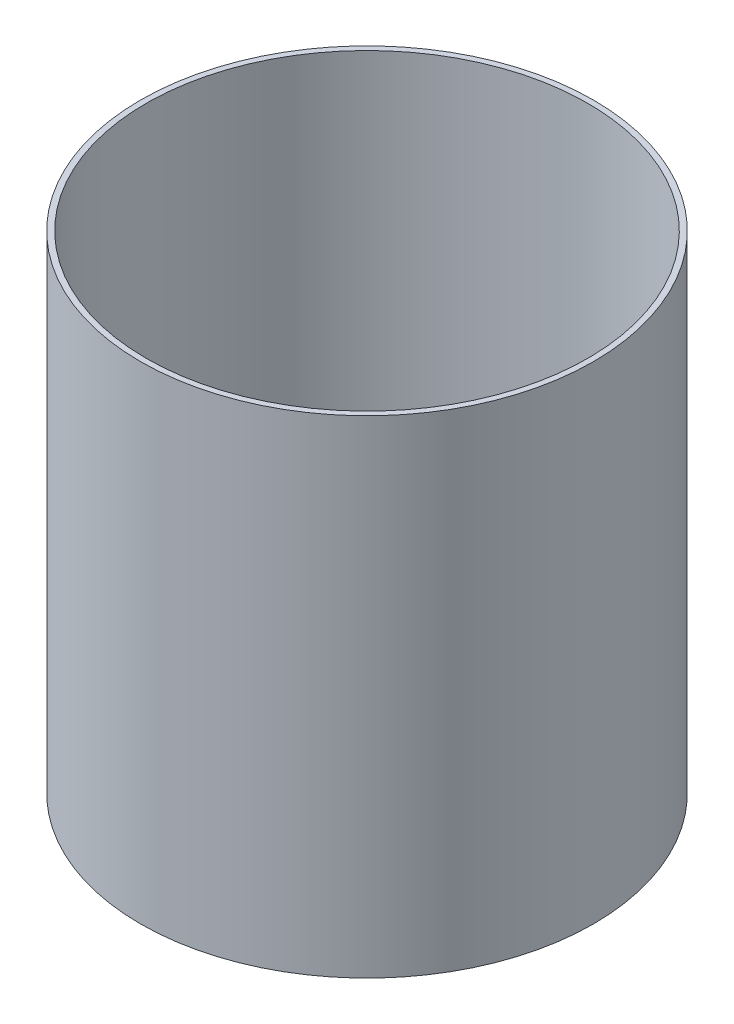
from build123d import *

# Parameters (mm, degrees)
SKETCH_1_R      = 200
SKETCH_1_R_2    = 195
EXTRUDE_1_DEPTH = 430


with BuildPart() as part:
    # 草图1 → 凸台-拉伸1 (new body)
    with BuildSketch(Plane(origin=(0, 0, 0), x_dir=(1, 0, 0), z_dir=(0, 1, 0))):
        with Locations(Location((0, 0, 0), (0, 0, 270))):
            Circle(SKETCH_1_R)
        with Locations(Location((0, 0, 0), (0, 0, 270))):
            Circle(SKETCH_1_R_2, mode=Mode.SUBTRACT)
    extrude(amount=EXTRUDE_1_DEPTH)


solid = part.part
